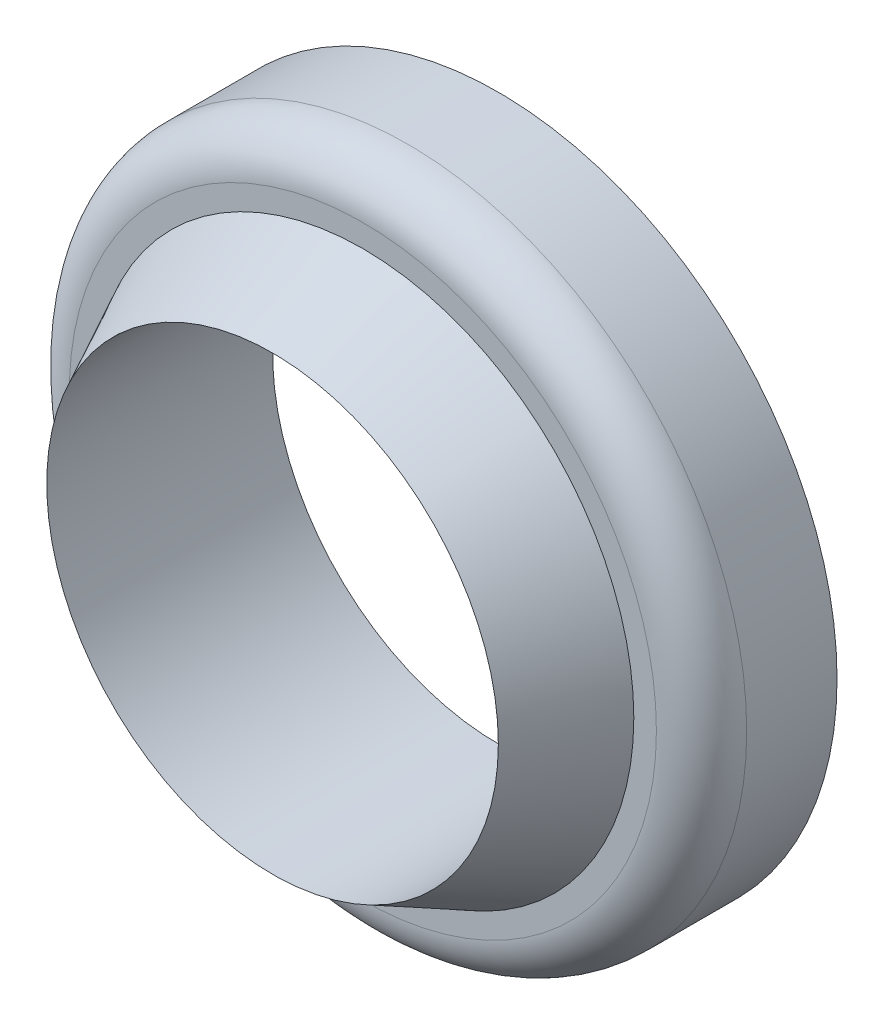
from build123d import *


with BuildPart() as part:
    # Schizzo1 → Rivoluzione1 (revolve)
    with BuildSketch(Plane(origin=(0, 0, 0), x_dir=(0, 0, -1), z_dir=(1, 0, 0)), mode=Mode.PRIVATE) as rivoluzione1_sk:
        with BuildLine():
            Line((0, 5), (0, 7.5))
            Line((0, 7.5), (-2, 7.5))
            ThreePointArc((-2, 7.5), (-2.707106781, 7.207106781), (-3, 6.5))
            Line((-3, 6.5), (-3, 6))
            Line((-3, 6), (-5, 5))
            Line((-5, 5), (0, 5))
        make_face()
    revolve(rivoluzione1_sk.sketch.rotate(Axis((0, 0, 48.055155589), (0, 0, -1)), 90), axis=Axis((0, 0, 48.055155589), (0, 0, -1)))


solid = part.part
